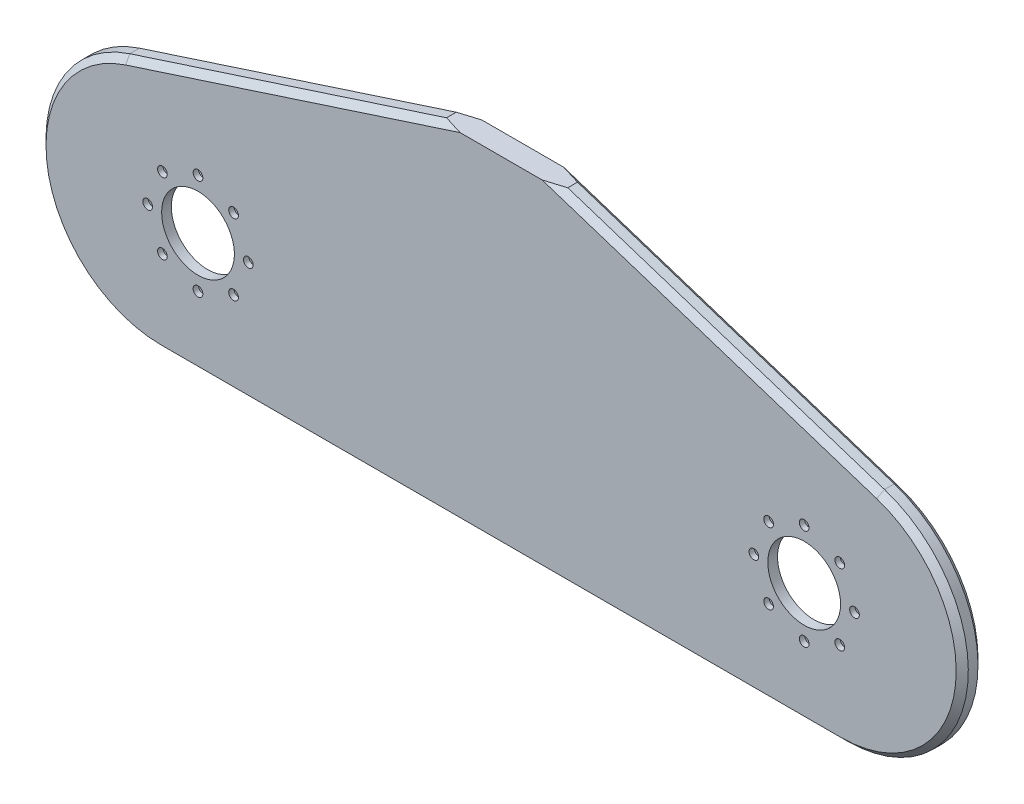
from build123d import *

# Parameters (mm, degrees)
SKETCH_1_R               = 30
EXTRUDE_1_DEPTH          = 8
FILLET_1_R               = 100
FILLET_3_R               = 100
EXTRUDE_2_DEPTH          = 10
FILLET_2_R               = 10
CHAMFER_1_SIZE           = 5
CUT_EXTRUDE_5_DEPTH      = 514.758413114
CUT_EXTRUDE_5_DEPTH_BACK = 514.758413114
SKETCH_8_R               = 2.25
SKETCH_9_R               = 4
CUT_EXTRUDE_6_DEPTH      = 4.4


with BuildPart() as part:
    # 草图1 → 凸台-拉伸1 (new body)
    with BuildSketch(Plane.XY):
        Polygon((0, 280), (861.751390409, 0), (0, 0), (-100, 0), (-961.751390409, 0), (-100, 280), align=None)
        with Locations((200, 100)):
            Circle(SKETCH_1_R, mode=Mode.SUBTRACT)
        with Locations(Location((-300, 100, 0), (0, 0, 180))):
            Circle(SKETCH_1_R, mode=Mode.SUBTRACT)
    extrude(amount=EXTRUDE_1_DEPTH)

    # 圆角1
    fillet_1_edges = [part.edges().sort_by_distance(p)[0] for p in [
        (861.751390409, 0, 4),
    ]]
    fillet(fillet_1_edges, radius=FILLET_1_R)

    # 圆角3
    fillet_3_edges = [part.edges().sort_by_distance(p)[0] for p in [
        (-961.751390409, 0, 4),
    ]]
    fillet(fillet_3_edges, radius=FILLET_3_R)

    # 草图2 → 凸台-拉伸2 (add)
    with BuildSketch(Plane.XY):
        with BuildLine():
            Line((0, 280), (-100, 280))
            Line((-100, 280), (-361.277938379, 195.10565163))
            ThreePointArc((-361.277938379, 195.10565163), (-429.145073001, 84.356553496), (-330.376238942, 0))
            Line((-330.376238942, 0), (230.376238942, 0))
            ThreePointArc((230.376238942, 0), (329.145073001, 84.356553496), (261.277938379, 195.10565163))
            Line((261.277938379, 195.10565163), (0, 280))
        make_face()
        Polygon((10, 266.236180795), (122.241374643, 229.766747442), (10, 35.358983849), align=None, mode=Mode.SUBTRACT)
        with BuildLine():
            Line((230.376238942, 10), (30, 10))
            Line((30, 10), (151.410485182, 220.289128906))
            Line((151.410485182, 220.289128906), (258.187768435, 185.595086467))
            ThreePointArc((258.187768435, 185.595086467), (319.268189595, 85.920898146), (230.376238942, 10))
        make_face(mode=Mode.SUBTRACT)
        Polygon((-110, 266.236180795), (-110, 35.358983849), (-222.241374643, 229.766747442), align=None, mode=Mode.SUBTRACT)
        with BuildLine():
            Line((-358.187768435, 185.595086467), (-251.410485182, 220.289128906))
            Line((-251.410485182, 220.289128906), (-130, 10))
            Line((-130, 10), (-330.376238942, 10))
            ThreePointArc((-330.376238942, 10), (-419.268189595, 85.920898146), (-358.187768435, 185.595086467))
        make_face(mode=Mode.SUBTRACT)
    extrude(amount=-EXTRUDE_2_DEPTH)

    # 圆角2
    fillet_2_edges = [part.edges().sort_by_distance(p)[0] for p in [
        (-110, 35.358983849, -5),
        (-110, 266.236180795, -5),
        (-130, 10, -5),
        (10, 266.236180795, -5),
        (10, 35.358983849, -5),
        (151.410485182, 220.289128906, -5),
        (30, 10, -5),
        (-251.410485182, 220.289128906, -5),
        (122.241374643, 229.766747442, -5),
        (-222.241374643, 229.766747442, -5),
    ]]
    fillet(fillet_2_edges, radius=FILLET_2_R)

    # 倒角1
    chamfer_1_edges = [part.edges().sort_by_distance(p)[0] for p in [
        (-230.63896919, 237.552825815, 8),
        (130.63896919, 237.552825815, 8),
        (329.145073001, 84.356553496, 8),
        (-50, 0, 8),
        (-429.145073001, 84.356553496, 8),
        (-230.63896919, 237.552825815, -10),
        (130.63896919, 237.552825815, -10),
        (329.145073001, 84.356553496, -10),
        (-50, 0, -10),
        (-429.145073001, 84.356553496, -10),
    ]]
    chamfer(chamfer_1_edges, length=CHAMFER_1_SIZE)

    # 草图8 → 切除-拉伸5 (cut, two sides: drawn at the far end of the back side and taken through both)
    with BuildSketch(Plane.XY.offset(8).offset(-CUT_EXTRUDE_5_DEPTH_BACK)):
        with Locations((200, 141.5)):
            Circle(SKETCH_8_R)
        with Locations((229.344931419, 129.344931419)):
            Circle(SKETCH_8_R)
        with Locations((241.5, 100)):
            Circle(SKETCH_8_R)
        with Locations((229.344931419, 70.655068581)):
            Circle(SKETCH_8_R)
        with Locations((200, 58.5)):
            Circle(SKETCH_8_R)
        with Locations((170.655068581, 70.655068581)):
            Circle(SKETCH_8_R)
        with Locations((158.5, 100)):
            Circle(SKETCH_8_R)
        with Locations((170.655068581, 129.344931419)):
            Circle(SKETCH_8_R)
        with Locations((-270.655068581, 129.344931419)):
            Circle(SKETCH_8_R)
        with Locations((-258.5, 100)):
            Circle(SKETCH_8_R)
        with Locations((-270.655068581, 70.655068581)):
            Circle(SKETCH_8_R)
        with Locations((-300, 58.5)):
            Circle(SKETCH_8_R)
        with Locations((-329.344931419, 70.655068581)):
            Circle(SKETCH_8_R)
        with Locations((-341.5, 100)):
            Circle(SKETCH_8_R)
        with Locations((-329.344931419, 129.344931419)):
            Circle(SKETCH_8_R)
        with Locations((-300, 141.5)):
            Circle(SKETCH_8_R)
    extrude(amount=CUT_EXTRUDE_5_DEPTH + CUT_EXTRUDE_5_DEPTH_BACK, mode=Mode.SUBTRACT)

    # 草图9 → 切除-拉伸6 (cut)
    with BuildSketch(Plane.XY.offset(8)):
        with Locations((-300, 141.5)):
            Circle(SKETCH_9_R)
        with Locations((-270.655068581, 129.344931419)):
            Circle(SKETCH_9_R)
        with Locations((-258.5, 100)):
            Circle(SKETCH_9_R)
        with Locations((-270.655068581, 70.655068581)):
            Circle(SKETCH_9_R)
        with Locations((-300, 58.5)):
            Circle(SKETCH_9_R)
        with Locations((-329.344931419, 70.655068581)):
            Circle(SKETCH_9_R)
        with Locations((-341.5, 100)):
            Circle(SKETCH_9_R)
        with Locations((-329.344931419, 129.344931419)):
            Circle(SKETCH_9_R)
        with Locations(Location((229.344931419, 129.344931419, 0), (0, 0, 180))):
            Circle(SKETCH_9_R)
        with Locations(Location((241.5, 100, 0), (0, 0, 180))):
            Circle(SKETCH_9_R)
        with Locations(Location((229.344931419, 70.655068581, 0), (0, 0, 180))):
            Circle(SKETCH_9_R)
        with Locations(Location((200, 58.5, 0), (0, 0, 180))):
            Circle(SKETCH_9_R)
        with Locations(Location((170.655068581, 70.655068581, 0), (0, 0, 180))):
            Circle(SKETCH_9_R)
        with Locations(Location((158.5, 100, 0), (0, 0, 180))):
            Circle(SKETCH_9_R)
        with Locations(Location((170.655068581, 129.344931419, 0), (0, 0, 180))):
            Circle(SKETCH_9_R)
        with Locations(Location((200, 141.5, 0), (0, 0, 180))):
            Circle(SKETCH_9_R)
    extrude(amount=-CUT_EXTRUDE_6_DEPTH, mode=Mode.SUBTRACT)


solid = part.part
